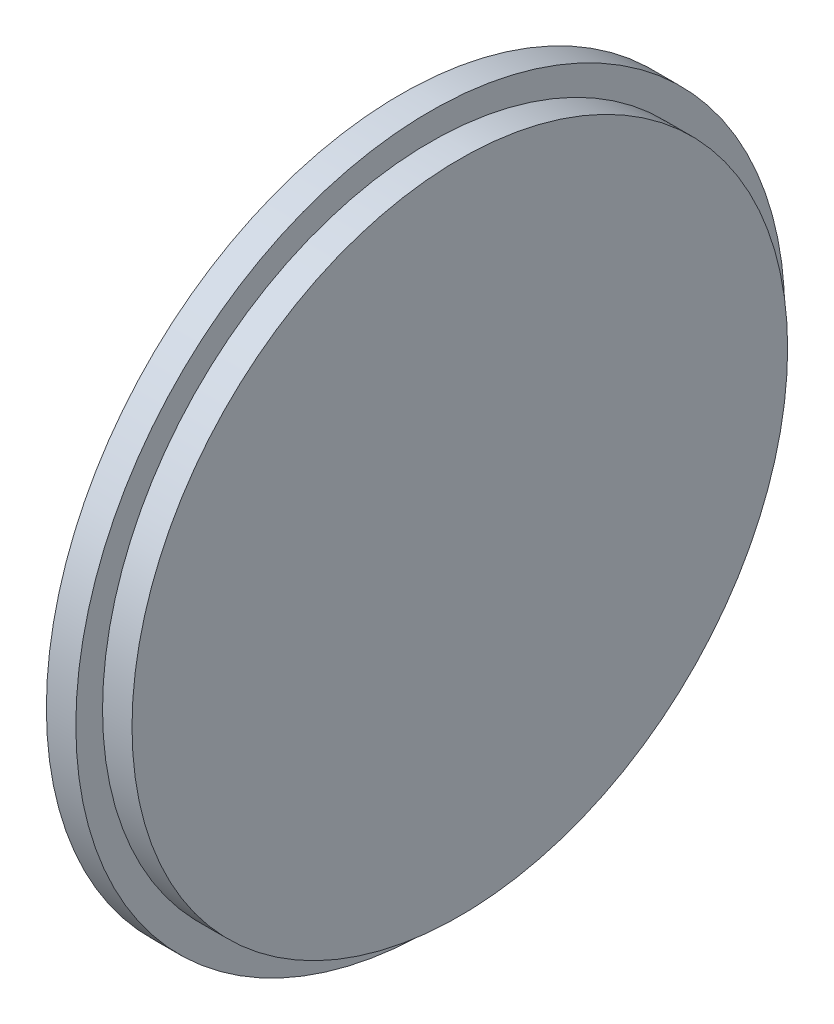
from build123d import *

# Parameters (mm, degrees)
S_CYL1_R     = 19.25
BOSS_1_DEPTH = 1.6
S_CYL2_R     = 17.8
BOSS_2_DEPTH = 1.6


with BuildPart() as part:
    # S_cyl1 → Boss_1 (new body)
    with BuildSketch(Plane(origin=(26.3, 0, 0), x_dir=(0, 0, -1), z_dir=(1, 0, 0))):
        with Locations((-30, 0)):
            Circle(S_CYL1_R)
    extrude(amount=BOSS_1_DEPTH)

    # S_cyl2 → Boss_2 (add)
    with BuildSketch(Plane(origin=(27.9, 0, 0), x_dir=(0, 0, -1), z_dir=(1, 0, 0))):
        with Locations((-30, 0)):
            Circle(S_CYL2_R)
    extrude(amount=BOSS_2_DEPTH)


solid = part.part
